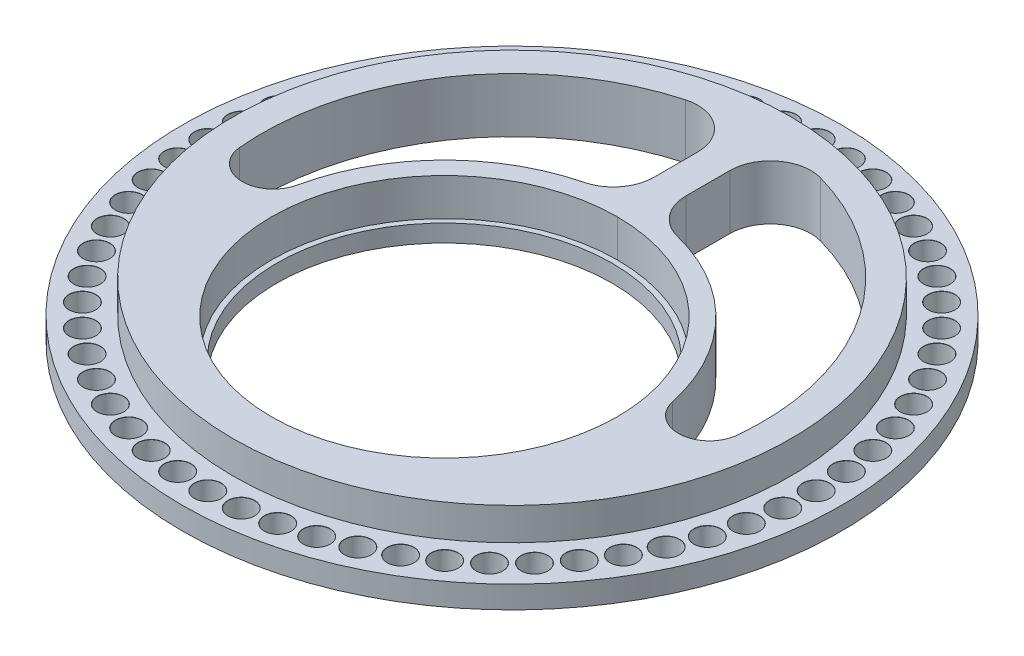
from build123d import *

# Parameters (mm, degrees)
SKETCH1_R                  = 61.9125
SKETCH1_R_2                = 30.988
SLOTTED_BODY_EXTRUDE_DEPTH = 4.191
SKETCH5_R                  = 52.3875
BOSS_EXTRUDE3_DEPTH        = 6.080000032
SKETCH6_R                  = 32.512
CUT_EXTRUDE5_DEPTH         = 89.157862691
SKETCH8_R                  = 32.512
SKETCH8_R_2                = 31.496
BOSS_EXTRUDE4_DEPTH        = 3.255000094
CIRPATTERN1_COUNT          = 60


with BuildPart() as part:
    # Sketch1 → Slotted-Body Extrude (new body)
    with BuildSketch(Plane(origin=(0, 0, 0), x_dir=(1, 0, 0), z_dir=(0, 1, 0))):
        with Locations(Location((0, 0, 0), (0, 0, 270))):
            Circle(SKETCH1_R)
        with Locations(Location((0, -12.7, 0), (0, 0, 270))):
            Circle(SKETCH1_R_2, mode=Mode.SUBTRACT)
    extrude(amount=SLOTTED_BODY_EXTRUDE_DEPTH)

    # Sketch5 → Boss-Extrude3 (add)
    with BuildSketch(Plane(origin=(0, 4.191, 0), x_dir=(1, 0, 0), z_dir=(0, 1, 0))):
        with Locations(Location((0, 0, 0), (0, 0, 270))):
            Circle(SKETCH5_R)
    extrude(amount=BOSS_EXTRUDE3_DEPTH)

    # Sketch6 → Cut-Extrude5 (cut, through all)
    with BuildSketch(Plane.XZ):
        with Locations(Location((0, 12.7, 0), (0, 0, 270))):
            Circle(SKETCH6_R)
        with BuildLine():
            Line((3.013951015, -37.906674687), (3.013951015, -29.674053734))
            ThreePointArc((3.013951015, -29.674053734), (4.62572071, -24.987309811), (8.779192117, -22.283230408))
            ThreePointArc((8.779192117, -22.283230408), (25.925135322, -12.375645206), (35.256203169, 5.09074497))
            ThreePointArc((35.256203169, 5.09074497), (41.313127715, 9.689980346), (46.782976949, 4.406037654))
            ThreePointArc((46.782976949, 4.406037654), (38.737451576, -26.59830719), (12.692135082, -45.243450433))
            ThreePointArc((12.692135082, -45.243450433), (6.03063496, -43.979061474), (3.013951015, -37.906674687))
        make_face()
        with BuildLine():
            Line((-3.013951015, -37.906674687), (-3.013951015, -29.674053734))
            ThreePointArc((-3.013951015, -29.674053734), (-4.62572071, -24.987309811), (-8.779192117, -22.283230408))
            ThreePointArc((-8.779192117, -22.283230408), (-25.925135322, -12.375645206), (-35.256203169, 5.09074497))
            ThreePointArc((-35.256203169, 5.09074497), (-41.313127715, 9.689980346), (-46.782976949, 4.406037654))
            ThreePointArc((-46.782976949, 4.406037654), (-38.737451576, -26.59830719), (-12.692135082, -45.243450433))
            ThreePointArc((-12.692135082, -45.243450433), (-6.03063496, -43.979061474), (-3.013951015, -37.906674687))
        make_face()
    extrude(amount=-CUT_EXTRUDE5_DEPTH, mode=Mode.SUBTRACT)

    # Sketch10 → Ø5.0mm Dowel Hole1 (revolve, cut)
    with BuildSketch(Plane(origin=(0, 4.191, -57.15), x_dir=(0, 0, 1), z_dir=(1, 0, 0))):
        Polygon((0, 0), (0, 4.191), (2.5, 4.191), (2.5, 0.025), (2.525, 0), align=None)
    f_5_0mm_dowel_hole1 = revolve(axis=Axis((0, 10.541, -57.15), (0, -1, 0)), mode=Mode.SUBTRACT)

    # CirPattern1: Ø5.0mm Dowel Hole1 ×60 about axis
    cirpattern1_axis = Axis((0, 0, 0), (0, 1, 0))
    for i in range(1, CIRPATTERN1_COUNT):
        add(f_5_0mm_dowel_hole1.rotate(cirpattern1_axis, i * 360 / CIRPATTERN1_COUNT), mode=Mode.SUBTRACT)


with BuildPart() as body_2:
    # Sketch8 → Boss-Extrude4 (new body)
    with BuildSketch(Plane.XZ):
        with Locations(Location((0, 12.7, 0), (0, 0, 270))):
            Circle(SKETCH8_R)
        with Locations(Location((0, 12.7, 0), (0, 0, 270))):
            Circle(SKETCH8_R_2, mode=Mode.SUBTRACT)
    extrude(amount=-BOSS_EXTRUDE4_DEPTH)


solid = Compound([part.part, body_2.part])
